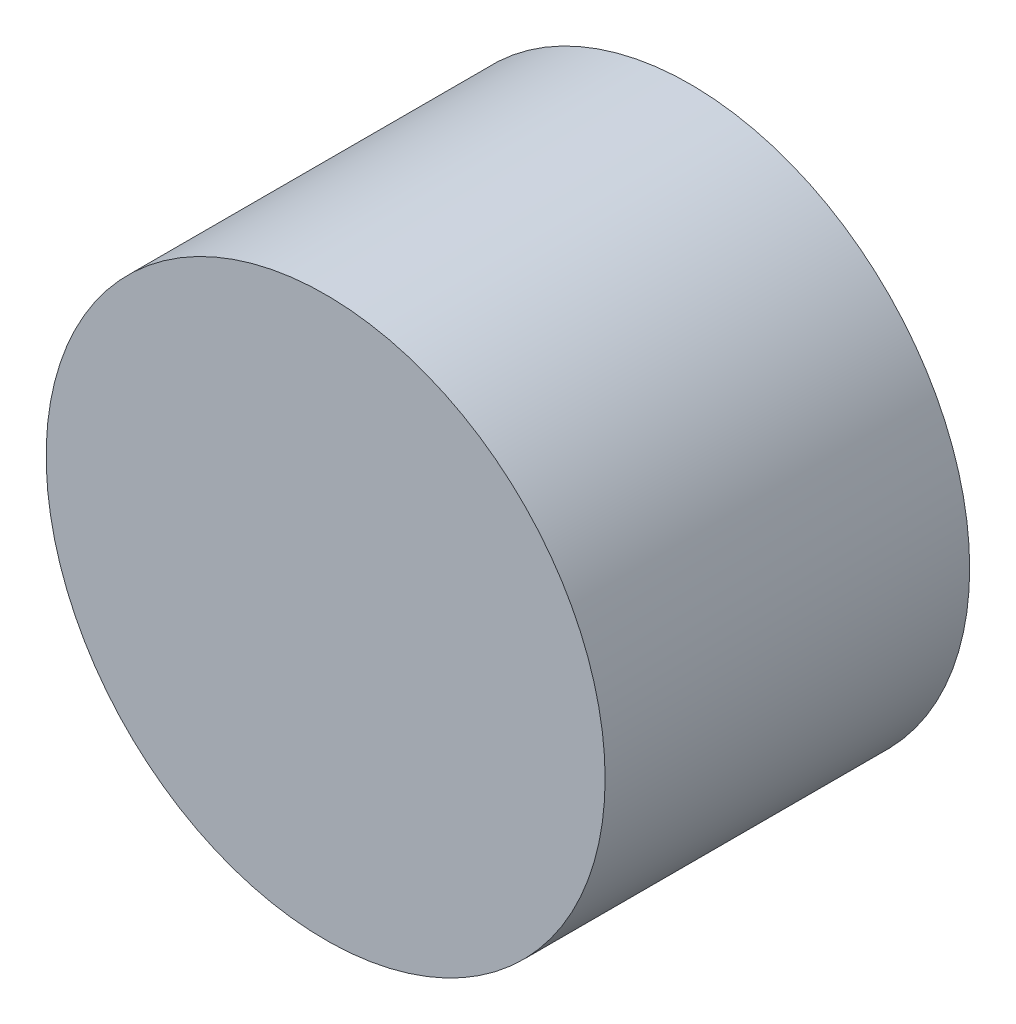
from build123d import *

# Parameters (mm, degrees)
SKETCH_1_R      = 2.3
EXTRUDE_1_DEPTH = 3


with BuildPart() as part:
    # 草圖1 → 填料-伸長1 (new body)
    with BuildSketch(Plane.XY):
        Circle(SKETCH_1_R)
    extrude(amount=EXTRUDE_1_DEPTH)


solid = part.part
